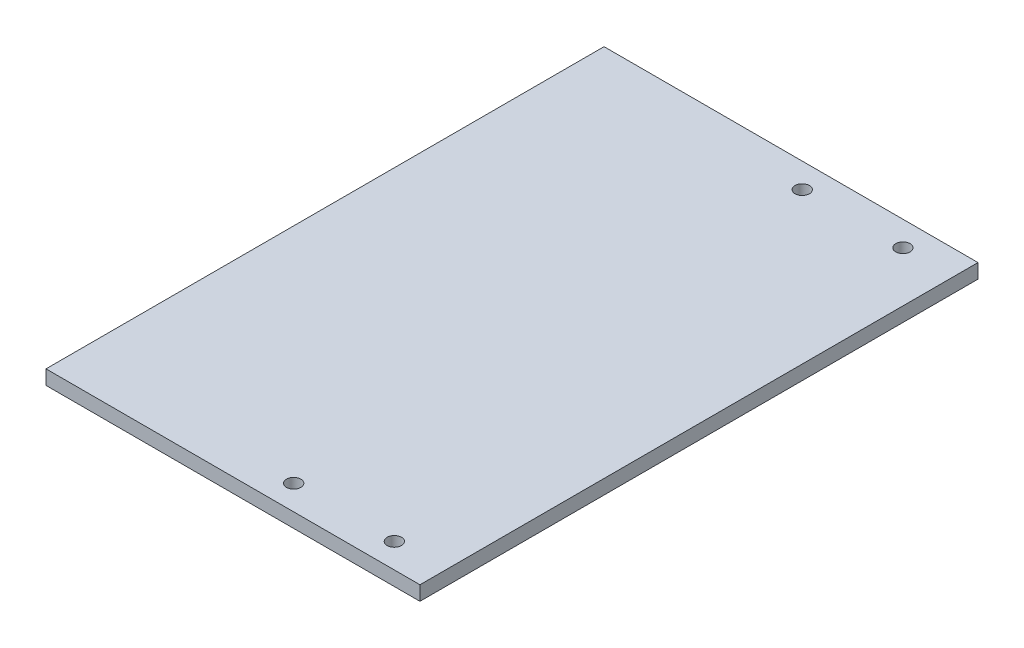
from build123d import *

# Parameters (mm, degrees)
SKETCH1_W           = 130
SKETCH1_H           = 194
SKETCH1_R           = 2.5
BOSS_EXTRUDE1_DEPTH = 5


with BuildPart() as part:
    # Sketch1 → Boss-Extrude1 (new body)
    with BuildSketch(Plane(origin=(0, 0, 0), x_dir=(1, 0, 0), z_dir=(0, 1, 0))):
        with Locations((65, -97)):
            Rectangle(SKETCH1_W, SKETCH1_H)
        with Locations(Location((77.5, -8.599150544, 0), (0, 0, 270))):
            Circle(SKETCH1_R, mode=Mode.SUBTRACT)
        with Locations(Location((112.5, -8.599150544, 0), (0, 0, 90))):
            Circle(SKETCH1_R, mode=Mode.SUBTRACT)
        with Locations(Location((112.5, -185.400849456, 0), (0, 0, 270))):
            Circle(SKETCH1_R, mode=Mode.SUBTRACT)
        with Locations(Location((77.5, -185.400849456, 0), (0, 0, 90))):
            Circle(SKETCH1_R, mode=Mode.SUBTRACT)
    extrude(amount=BOSS_EXTRUDE1_DEPTH)


solid = part.part
